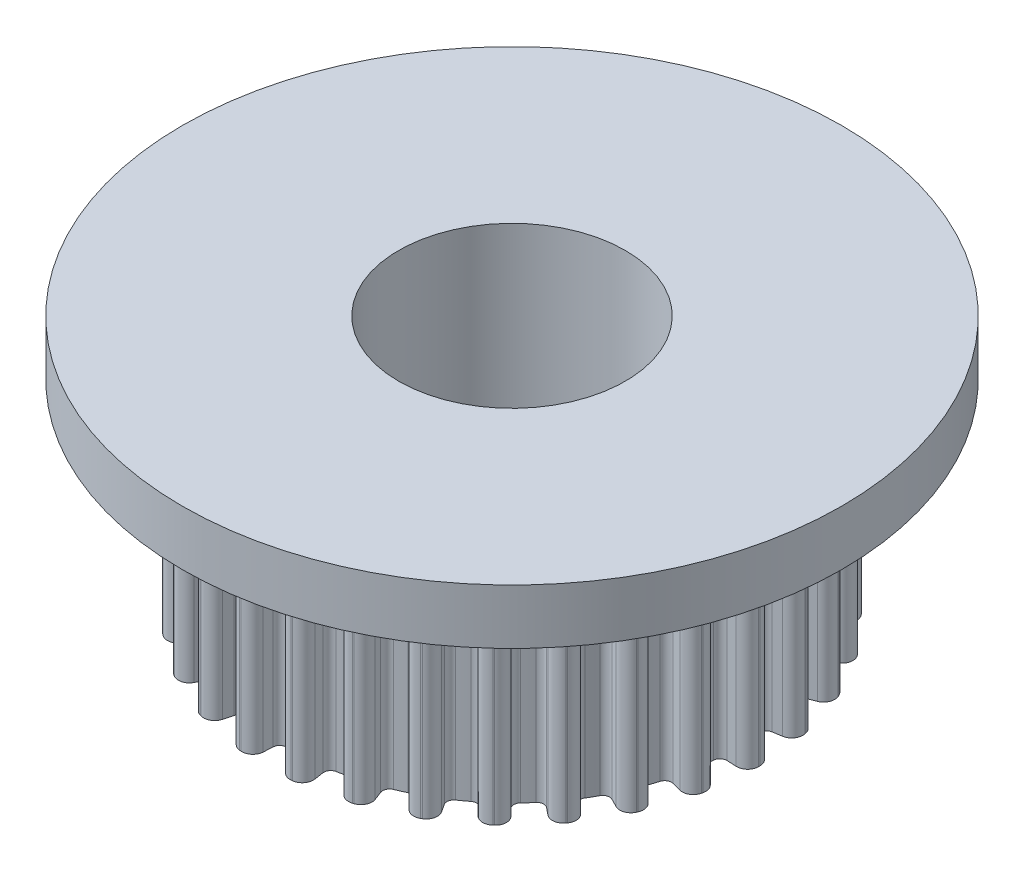
from build123d import *

# Parameters (mm, degrees)
SKETCH1_R                = 9
SKETCH1_R_2              = 4.125
BOSS_EXTRUDE1_DEPTH      = 7.7
CUT_EXTRUDE1_DEPTH       = 15.875819305
FILLET1_R                = 0.25
FILLET2_R                = 0.4
CIRPATTERN1_COUNT        = 30
FILLET1_OF_CIRPATTERN1_R = 0.25
FILLET2_OF_CIRPATTERN1_R = 0.4
SKETCH3_R                = 12
SKETCH3_R_2              = 4.125
BOSS_EXTRUDE2_DEPTH      = 2


with BuildPart() as part:
    # Sketch1 → Boss-Extrude1 (new body)
    with BuildSketch(Plane(origin=(0, 0, 0), x_dir=(1, 0, 0), z_dir=(0, 1, 0))):
        Circle(SKETCH1_R)
        Circle(SKETCH1_R_2, mode=Mode.SUBTRACT)
    extrude(amount=BOSS_EXTRUDE1_DEPTH)

    # Sketch2 → Cut-Extrude1 (cut, through all)
    with BuildSketch(Plane(origin=(0, 7.7, 0), x_dir=(1, 0, 0), z_dir=(0, 1, 0))):
        with BuildLine():
            ThreePointArc((0.444444444, -7.98764478), (0, -8), (-0.444444444, -7.98764478))
            Line((-0.444444444, -7.98764478), (-0.5, -8.986100378))
            ThreePointArc((-0.5, -8.986100378), (0, -9), (0.5, -8.986100378))
            Line((0.5, -8.986100378), (0.444444444, -7.98764478))
        make_face()
    cut_extrude1 = extrude(amount=-CUT_EXTRUDE1_DEPTH, mode=Mode.SUBTRACT)

    # Fillet1
    fillet1_edges = [part.edges().sort_by_distance(p)[0] for p in [
        (0.444444444, 3.85, 7.98764478),
        (-0.444444444, 3.85, 7.98764478),
    ]]
    fillet(fillet1_edges, radius=FILLET1_R)

    # Fillet2
    fillet2_edges = [part.edges().sort_by_distance(p)[0] for p in [
        (0.5, 3.85, 8.986100378),
        (-0.5, 3.85, 8.986100378),
    ]]
    fillet(fillet2_edges, radius=FILLET2_R)

    # CirPattern1: Cut-Extrude1 ×30 about axis
    cirpattern1_axis = Axis((0, 7.7, 0), (0, -1, 0))
    for i in range(1, CIRPATTERN1_COUNT):
        add(cut_extrude1.rotate(cirpattern1_axis, i * 360 / CIRPATTERN1_COUNT), mode=Mode.SUBTRACT)

    # Fillet1 of CirPattern1
    fillet1_of_cirpattern1_edges = [part.edges().sort_by_distance(p)[0] for p in [
        (-1.225992465, 3.85, 7.905500773),
        (-2.095456999, 3.85, 7.720690381),
        (-2.842847621, 3.85, 7.477848448),
        (-3.654888027, 3.85, 7.116304765),
        (-4.335456694, 3.85, 6.723378262),
        (-5.054582911, 3.85, 6.200902482),
        (-5.638585506, 3.85, 5.675064184),
        (-6.233368267, 3.85, 5.014491006),
        (-6.695281074, 3.85, 4.37872257),
        (-7.139725518, 3.85, 3.608922211),
        (-7.459360732, 3.85, 2.891009767),
        (-7.734042505, 3.85, 2.045626197),
        (-7.897430532, 3.85, 1.276945965),
        (-7.990344721, 3.85, 0.392926503),
        (-7.990344721, 3.85, -0.392926503),
        (-7.897430532, 3.85, -1.276945965),
        (-7.734042505, 3.85, -2.045626197),
        (-7.459360732, 3.85, -2.891009767),
        (-7.139725518, 3.85, -3.608922211),
        (-6.695281074, 3.85, -4.37872257),
        (-6.233368267, 3.85, -5.014491006),
        (-5.638585506, 3.85, -5.675064184),
        (-5.054582911, 3.85, -6.200902482),
        (-4.335456694, 3.85, -6.723378262),
        (-3.654888027, 3.85, -7.116304765),
        (-2.842847621, 3.85, -7.477848448),
        (-2.095456999, 3.85, -7.720690381),
        (-1.225992465, 3.85, -7.905500773),
        (-0.444444444, 3.85, -7.98764478),
        (0.444444444, 3.85, -7.98764478),
        (1.225992465, 3.85, -7.905500773),
        (2.095456999, 3.85, -7.720690381),
        (2.842847621, 3.85, -7.477848448),
        (3.654888027, 3.85, -7.116304765),
        (4.335456694, 3.85, -6.723378262),
        (5.054582911, 3.85, -6.200902482),
        (5.638585506, 3.85, -5.675064184),
        (6.233368267, 3.85, -5.014491006),
        (6.695281074, 3.85, -4.37872257),
        (7.139725518, 3.85, -3.608922211),
        (7.459360732, 3.85, -2.891009767),
        (7.734042505, 3.85, -2.045626197),
        (7.897430532, 3.85, -1.276945965),
        (7.990344721, 3.85, -0.392926503),
        (7.990344721, 3.85, 0.392926503),
        (7.897430532, 3.85, 1.276945965),
        (7.734042505, 3.85, 2.045626197),
        (7.459360732, 3.85, 2.891009767),
        (7.139725518, 3.85, 3.608922211),
        (6.695281074, 3.85, 4.37872257),
        (6.233368267, 3.85, 5.014491006),
        (5.638585506, 3.85, 5.675064184),
        (5.054582911, 3.85, 6.200902482),
        (4.335456694, 3.85, 6.723378262),
        (3.654888027, 3.85, 7.116304765),
        (2.842847621, 3.85, 7.477848448),
        (2.095456999, 3.85, 7.720690381),
        (1.225992465, 3.85, 7.905500773),
    ]]
    fillet(fillet1_of_cirpattern1_edges, radius=FILLET1_OF_CIRPATTERN1_R)

    # Fillet2 of CirPattern1
    fillet2_of_cirpattern1_edges = [part.edges().sort_by_distance(p)[0] for p in [
        (-1.379241523, 3.85, 8.89368837),
        (-2.357389124, 3.85, 8.685776679),
        (-3.198203573, 3.85, 8.412579504),
        (-4.111749031, 3.85, 8.005842861),
        (-4.877388781, 3.85, 7.563800545),
        (-5.686405775, 3.85, 6.976015293),
        (-6.343408694, 3.85, 6.384447207),
        (-7.0125393, 3.85, 5.641302382),
        (-7.532191208, 3.85, 4.926062891),
        (-8.032191208, 3.85, 4.060037487),
        (-8.391780823, 3.85, 3.252385988),
        (-8.700797818, 3.85, 2.301329472),
        (-8.884609348, 3.85, 1.436564211),
        (-8.989137811, 3.85, 0.442042316),
        (-8.989137811, 3.85, -0.442042316),
        (-8.884609348, 3.85, -1.436564211),
        (-8.700797818, 3.85, -2.301329472),
        (-8.391780823, 3.85, -3.252385988),
        (-8.032191208, 3.85, -4.060037487),
        (-7.532191208, 3.85, -4.926062891),
        (-7.0125393, 3.85, -5.641302382),
        (-6.343408694, 3.85, -6.384447207),
        (-5.686405775, 3.85, -6.976015293),
        (-4.877388781, 3.85, -7.563800545),
        (-4.111749031, 3.85, -8.005842861),
        (-3.198203573, 3.85, -8.412579504),
        (-2.357389124, 3.85, -8.685776679),
        (-1.379241523, 3.85, -8.89368837),
        (-0.5, 3.85, -8.986100378),
        (0.5, 3.85, -8.986100378),
        (1.379241523, 3.85, -8.89368837),
        (2.357389124, 3.85, -8.685776679),
        (3.198203573, 3.85, -8.412579504),
        (4.111749031, 3.85, -8.005842861),
        (4.877388781, 3.85, -7.563800545),
        (5.686405775, 3.85, -6.976015293),
        (6.343408694, 3.85, -6.384447207),
        (7.0125393, 3.85, -5.641302382),
        (7.532191208, 3.85, -4.926062891),
        (8.032191208, 3.85, -4.060037487),
        (8.391780823, 3.85, -3.252385988),
        (8.700797818, 3.85, -2.301329472),
        (8.884609348, 3.85, -1.436564211),
        (8.989137811, 3.85, -0.442042316),
        (8.989137811, 3.85, 0.442042316),
        (8.884609348, 3.85, 1.436564211),
        (8.700797818, 3.85, 2.301329472),
        (8.391780823, 3.85, 3.252385988),
        (8.032191208, 3.85, 4.060037487),
        (7.532191208, 3.85, 4.926062891),
        (7.0125393, 3.85, 5.641302382),
        (6.343408694, 3.85, 6.384447207),
        (5.686405775, 3.85, 6.976015293),
        (4.877388781, 3.85, 7.563800545),
        (4.111749031, 3.85, 8.005842861),
        (3.198203573, 3.85, 8.412579504),
        (2.357389124, 3.85, 8.685776679),
        (1.379241523, 3.85, 8.89368837),
    ]]
    fillet(fillet2_of_cirpattern1_edges, radius=FILLET2_OF_CIRPATTERN1_R)

    # Sketch3 → Boss-Extrude2 (add)
    with BuildSketch(Plane(origin=(0, 7.7, 0), x_dir=(1, 0, 0), z_dir=(0, 1, 0))):
        Circle(SKETCH3_R)
        Circle(SKETCH3_R_2, mode=Mode.SUBTRACT)
    extrude(amount=BOSS_EXTRUDE2_DEPTH)


solid = part.part
